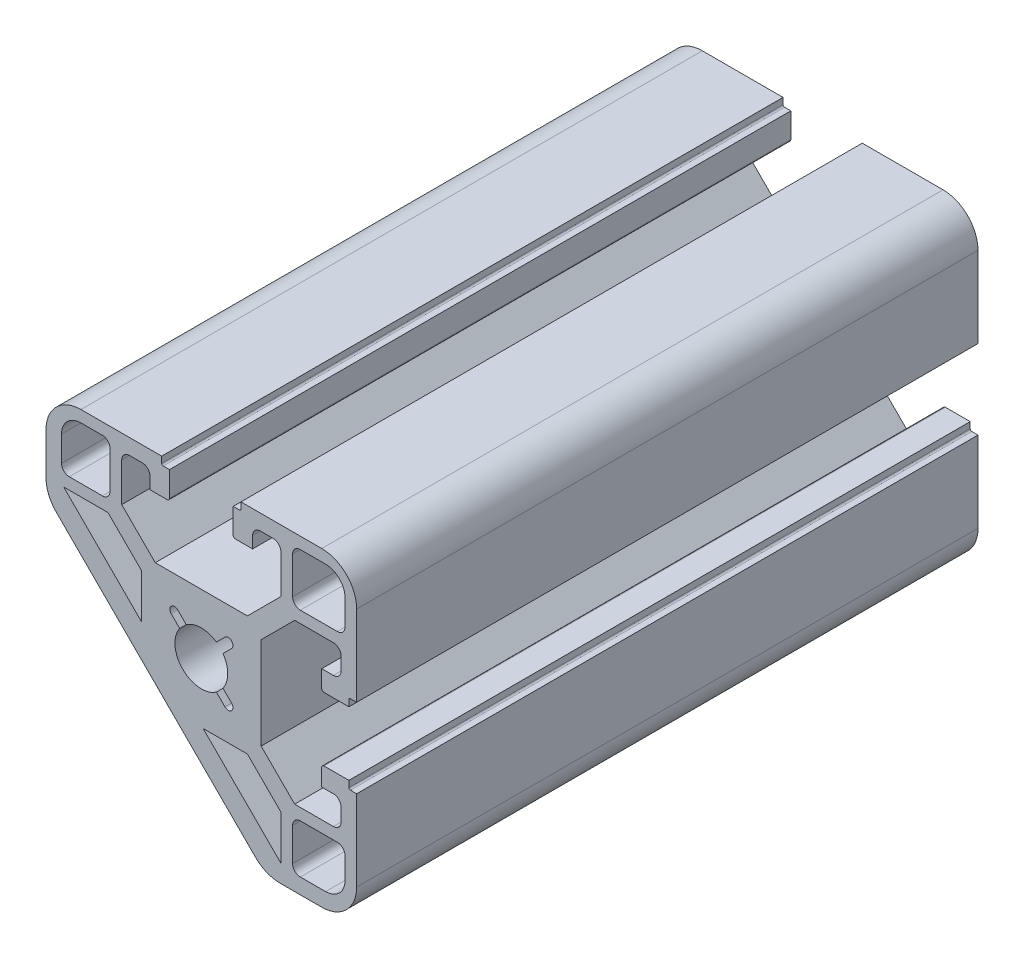
from build123d import *

# Parameters (mm, degrees)
EXTRUDE_1_DEPTH = 80


with BuildPart() as part:
    # 草图1 → 凸台-拉伸1 (new body)
    with BuildSketch(Plane.XY):
        with BuildLine():
            Line((2339.183862097, 210.472909404), (2328.783862097, 210.472909404))
            ThreePointArc((2328.783862097, 210.472909404), (2325.601881582, 209.15488992), (2324.283862097, 205.972909404))
            Line((2324.283862097, 205.972909404), (2324.283862097, 200.621141682))
            ThreePointArc((2324.283862097, 200.621141682), (2324.626404201, 198.899066237), (2325.601881582, 197.439161167))
            Line((2325.601881582, 197.439161167), (2351.25011386, 171.790928889))
            ThreePointArc((2351.25011386, 171.790928889), (2352.71001893, 170.815451508), (2354.432094375, 170.472909404))
            Line((2354.432094375, 170.472909404), (2359.783862097, 170.472909404))
            ThreePointArc((2359.783862097, 170.472909404), (2362.965842612, 171.790928889), (2364.283862097, 174.972909404))
            Line((2364.283862097, 174.972909404), (2364.283862097, 185.372909404))
            Line((2364.283862097, 185.372909404), (2363.483862097, 185.372909404))
            ThreePointArc((2363.483862097, 185.372909404), (2363.342440741, 185.431488048), (2363.283862097, 185.572909404))
            Line((2363.283862097, 185.572909404), (2363.283862097, 186.372909404))
            Line((2363.283862097, 186.372909404), (2360.083862097, 186.372909404))
            ThreePointArc((2360.083862097, 186.372909404), (2359.871730063, 186.285041439), (2359.783862097, 186.072909404))
            Line((2359.783862097, 186.072909404), (2359.783862097, 183.872909404))
            Line((2359.783862097, 183.872909404), (2361.283862097, 183.872909404))
            ThreePointArc((2361.283862097, 183.872909404), (2361.990968878, 183.580016185), (2362.283862097, 182.872909404))
            Line((2362.283862097, 182.872909404), (2362.283862097, 181.222909404))
            ThreePointArc((2362.283862097, 181.222909404), (2361.990968878, 180.515802623), (2361.283862097, 180.222909404))
            Line((2361.283862097, 180.222909404), (2356.30162905, 180.222909404))
            Line((2356.30162905, 180.222909404), (2351.983862097, 184.540676357))
            Line((2351.983862097, 184.540676357), (2351.983862097, 196.405142451))
            Line((2351.983862097, 196.405142451), (2356.30162905, 200.722909404))
            Line((2356.30162905, 200.722909404), (2361.283862097, 200.722909404))
            ThreePointArc((2361.283862097, 200.722909404), (2361.990968878, 200.430016185), (2362.283862097, 199.722909404))
            Line((2362.283862097, 199.722909404), (2362.283862097, 198.072909404))
            ThreePointArc((2362.283862097, 198.072909404), (2361.990968878, 197.365802623), (2361.283862097, 197.072909404))
            Line((2361.283862097, 197.072909404), (2359.783862097, 197.072909404))
            Line((2359.783862097, 197.072909404), (2359.783862097, 194.872909404))
            ThreePointArc((2359.783862097, 194.872909404), (2359.871730063, 194.66077737), (2360.083862097, 194.572909404))
            Line((2360.083862097, 194.572909404), (2363.283862097, 194.572909404))
            Line((2363.283862097, 194.572909404), (2363.283862097, 195.372909404))
            ThreePointArc((2363.283862097, 195.372909404), (2363.342440741, 195.514330761), (2363.483862097, 195.572909404))
            Line((2363.483862097, 195.572909404), (2364.283862097, 195.572909404))
            Line((2364.283862097, 195.572909404), (2364.283862097, 205.972909404))
            ThreePointArc((2364.283862097, 205.972909404), (2362.965842612, 209.15488992), (2359.783862097, 210.472909404))
            Line((2359.783862097, 210.472909404), (2349.383862097, 210.472909404))
            Line((2349.383862097, 210.472909404), (2349.383862097, 209.672909404))
            ThreePointArc((2349.383862097, 209.672909404), (2349.325283453, 209.531488048), (2349.183862097, 209.472909404))
            Line((2349.183862097, 209.472909404), (2348.383862097, 209.472909404))
            Line((2348.383862097, 209.472909404), (2348.383862097, 206.272909404))
            ThreePointArc((2348.383862097, 206.272909404), (2348.471730063, 206.06077737), (2348.683862097, 205.972909404))
            Line((2348.683862097, 205.972909404), (2350.883862097, 205.972909404))
            Line((2350.883862097, 205.972909404), (2350.883862097, 207.472909404))
            ThreePointArc((2350.883862097, 207.472909404), (2351.176755316, 208.180016185), (2351.883862097, 208.472909404))
            Line((2351.883862097, 208.472909404), (2353.533862097, 208.472909404))
            ThreePointArc((2353.533862097, 208.472909404), (2354.240968878, 208.180016185), (2354.533862097, 207.472909404))
            Line((2354.533862097, 207.472909404), (2354.533862097, 202.490676357))
            Line((2354.533862097, 202.490676357), (2350.216095144, 198.172909404))
            Line((2350.216095144, 198.172909404), (2338.35162905, 198.172909404))
            Line((2338.35162905, 198.172909404), (2334.033862097, 202.490676357))
            Line((2334.033862097, 202.490676357), (2334.033862097, 207.472909404))
            ThreePointArc((2334.033862097, 207.472909404), (2334.326755316, 208.180016185), (2335.033862097, 208.472909404))
            Line((2335.033862097, 208.472909404), (2336.683862097, 208.472909404))
            ThreePointArc((2336.683862097, 208.472909404), (2337.390968878, 208.180016185), (2337.683862097, 207.472909404))
            Line((2337.683862097, 207.472909404), (2337.683862097, 205.972909404))
            Line((2337.683862097, 205.972909404), (2339.883862097, 205.972909404))
            ThreePointArc((2339.883862097, 205.972909404), (2340.095994131, 206.06077737), (2340.183862097, 206.272909404))
            Line((2340.183862097, 206.272909404), (2340.183862097, 209.472909404))
            Line((2340.183862097, 209.472909404), (2339.383862097, 209.472909404))
            ThreePointArc((2339.383862097, 209.472909404), (2339.242440741, 209.531488048), (2339.183862097, 209.672909404))
            Line((2339.183862097, 209.672909404), (2339.183862097, 210.472909404))
        make_face()
        with BuildLine():
            Line((2326.279862097, 206.476909404), (2326.279862097, 203.222909404))
            ThreePointArc((2326.279862097, 203.222909404), (2326.572755316, 202.515802623), (2327.279862097, 202.222909404))
            Line((2327.279862097, 202.222909404), (2331.533862097, 202.222909404))
            ThreePointArc((2331.533862097, 202.222909404), (2332.240968878, 202.515802623), (2332.533862097, 203.222909404))
            Line((2332.533862097, 203.222909404), (2332.533862097, 207.976909404))
            ThreePointArc((2332.533862097, 207.976909404), (2332.240968878, 208.684016185), (2331.533862097, 208.976909404))
            Line((2331.533862097, 208.976909404), (2328.779862097, 208.976909404))
            ThreePointArc((2328.779862097, 208.976909404), (2327.012095144, 208.244676357), (2326.279862097, 206.476909404))
        make_face(mode=Mode.SUBTRACT)
        Polygon((2344.510774032, 182.772909404), (2350.216095144, 182.772909404), (2354.533862097, 178.455142451), (2354.533862097, 172.749821339), align=None, mode=Mode.SUBTRACT)
        Polygon((2336.583862097, 196.405142451), (2336.583862097, 190.699821339), (2326.560774032, 200.722909404), (2332.266095144, 200.722909404), align=None, mode=Mode.SUBTRACT)
        with BuildLine():
            Line((2362.787862097, 206.476909404), (2362.787862097, 203.222909404))
            ThreePointArc((2362.787862097, 203.222909404), (2362.494968878, 202.515802623), (2361.787862097, 202.222909404))
            Line((2361.787862097, 202.222909404), (2357.033862097, 202.222909404))
            ThreePointArc((2357.033862097, 202.222909404), (2356.326755316, 202.515802623), (2356.033862097, 203.222909404))
            Line((2356.033862097, 203.222909404), (2356.033862097, 207.976909404))
            ThreePointArc((2356.033862097, 207.976909404), (2356.326755316, 208.684016185), (2357.033862097, 208.976909404))
            Line((2357.033862097, 208.976909404), (2360.287862097, 208.976909404))
            ThreePointArc((2360.287862097, 208.976909404), (2362.05562905, 208.244676357), (2362.787862097, 206.476909404))
        make_face(mode=Mode.SUBTRACT)
        with BuildLine():
            Line((2362.787862097, 174.968909404), (2362.787862097, 177.722909404))
            ThreePointArc((2362.787862097, 177.722909404), (2362.494968878, 178.430016185), (2361.787862097, 178.722909404))
            Line((2361.787862097, 178.722909404), (2357.033862097, 178.722909404))
            ThreePointArc((2357.033862097, 178.722909404), (2356.326755316, 178.430016185), (2356.033862097, 177.722909404))
            Line((2356.033862097, 177.722909404), (2356.033862097, 173.468909404))
            ThreePointArc((2356.033862097, 173.468909404), (2356.326755316, 172.761802623), (2357.033862097, 172.468909404))
            Line((2357.033862097, 172.468909404), (2360.287862097, 172.468909404))
            ThreePointArc((2360.287862097, 172.468909404), (2362.05562905, 173.201142451), (2362.787862097, 174.968909404))
        make_face(mode=Mode.SUBTRACT)
        with BuildLine():
            Line((2347.324421256, 194.361996701), (2346.226029942, 193.263605386))
            ThreePointArc((2346.226029942, 193.263605386), (2344.283862097, 193.872909404), (2342.341694253, 193.263605386))
            Line((2342.341694253, 193.263605386), (2341.243302938, 194.361996701))
            ThreePointArc((2341.243302938, 194.361996701), (2340.394774801, 194.361996701), (2340.394774801, 193.513468563))
            Line((2340.394774801, 193.513468563), (2341.493166115, 192.415077249))
            ThreePointArc((2341.493166115, 192.415077249), (2341.879699041, 188.068746348), (2346.226029942, 187.682213422))
            Line((2346.226029942, 187.682213422), (2347.324421256, 186.583822108))
            ThreePointArc((2347.324421256, 186.583822108), (2348.172949394, 186.583822108), (2348.172949394, 187.432350245))
            Line((2348.172949394, 187.432350245), (2347.074558079, 188.53074156))
            ThreePointArc((2347.074558079, 188.53074156), (2347.683862097, 190.472909404), (2347.074558079, 192.415077249))
            Line((2347.074558079, 192.415077249), (2348.172949394, 193.513468563))
            ThreePointArc((2348.172949394, 193.513468563), (2348.172949394, 194.361996701), (2347.324421256, 194.361996701))
        make_face(mode=Mode.SUBTRACT)
    extrude(amount=EXTRUDE_1_DEPTH)


solid = part.part
